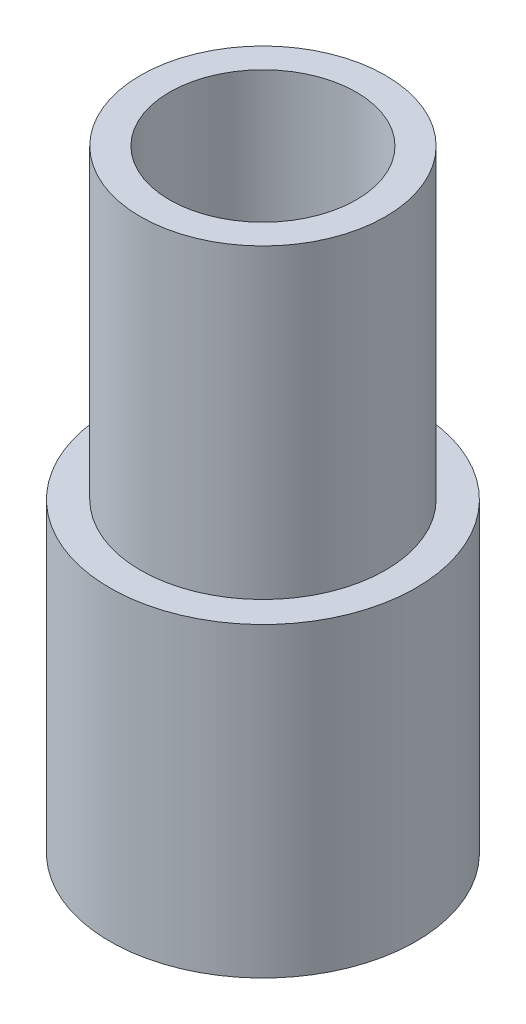
from build123d import *

# Parameters (mm, degrees)
SKETCH2_R           = 4
BOSS_EXTRUDE1_DEPTH = 10
SKETCH3_R           = 3.05
CUT_EXTRUDE3_DEPTH  = 8
SKETCH4_R           = 5
BOSS_EXTRUDE3_DEPTH = 10
SKETCH5_R           = 4.05
CUT_EXTRUDE4_DEPTH  = 8


with BuildPart() as part:
    # Sketch2 → Boss-Extrude1 (new body)
    with BuildSketch(Plane(origin=(0, 0, 0), x_dir=(1, 0, 0), z_dir=(0, 1, 0))):
        with Locations(Location((0, 0, 0), (0, 0, 270))):
            Circle(SKETCH2_R)
    extrude(amount=BOSS_EXTRUDE1_DEPTH)

    # Sketch3 → Cut-Extrude3 (cut)
    with BuildSketch(Plane(origin=(0, 10, 0), x_dir=(1, 0, 0), z_dir=(0, 1, 0))):
        with Locations(Location((0, 0, 0), (0, 0, 270))):
            Circle(SKETCH3_R)
    extrude(amount=-CUT_EXTRUDE3_DEPTH, mode=Mode.SUBTRACT)

    # Sketch4 → Boss-Extrude3 (add)
    with BuildSketch(Plane.XZ):
        with Locations(Location((0, 0, 0), (0, 0, 270))):
            Circle(SKETCH4_R)
    extrude(amount=BOSS_EXTRUDE3_DEPTH)

    # Sketch5 → Cut-Extrude4 (cut)
    with BuildSketch(Plane.XZ.offset(10)):
        with Locations(Location((0, 0, 0), (0, 0, 270))):
            Circle(SKETCH5_R)
    extrude(amount=-CUT_EXTRUDE4_DEPTH, mode=Mode.SUBTRACT)


solid = part.part
